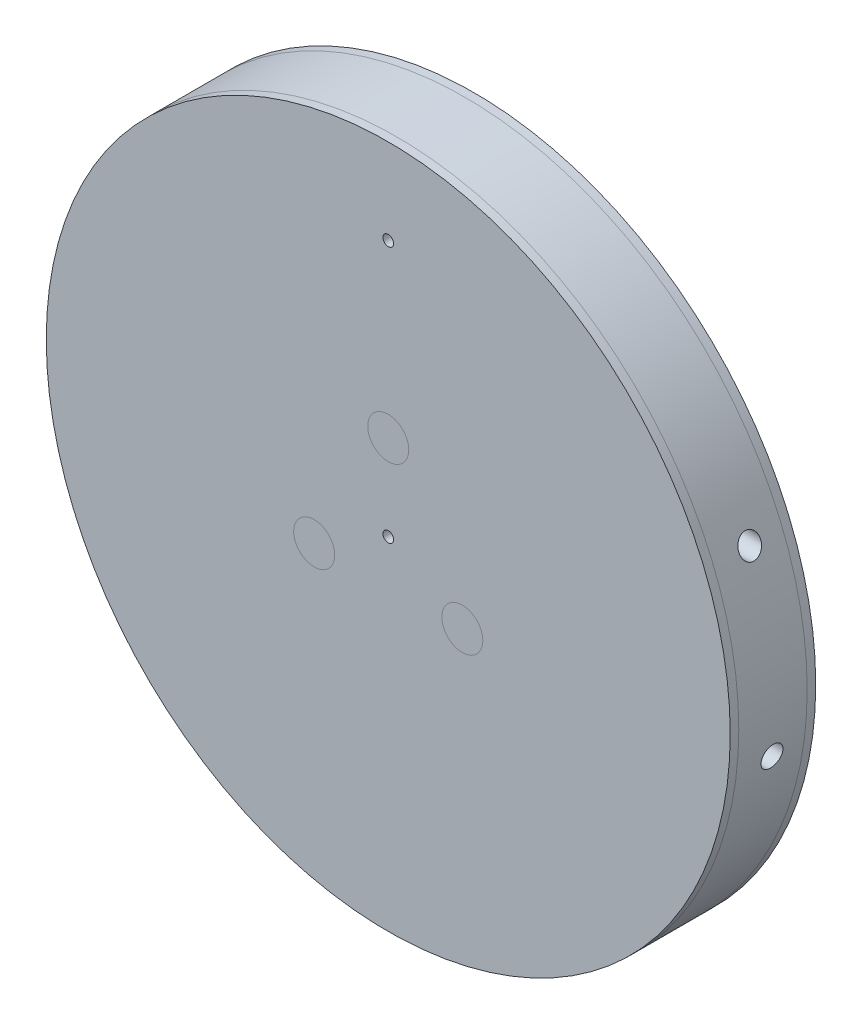
from build123d import *

# Parameters (mm, degrees)
SKETCH1_R               = 100
BOSS_EXTRUDE1_DEPTH     = 25
CUT_EXTRUDE1_DEPTH      = 144.614066163
CUT_EXTRUDE1_DEPTH_BACK = 55.2975
SKETCH2_R               = 3.2
CUT_EXTRUDE2_DEPTH      = 144.61406632
CUT_EXTRUDE2_DEPTH_BACK = 54.7843
SKETCH3_R               = 3.2
CUT_EXTRUDE3_DEPTH      = 54.7843
CUT_EXTRUDE3_DEPTH_BACK = 144.61406632
SKETCH4_R               = 3.2
CUT_EXTRUDE4_DEPTH      = 55.2975
CUT_EXTRUDE4_DEPTH_BACK = 144.61406632
SKETCH5_R               = 3.2
SKETCH6_R               = 50
BOSS_EXTRUDE5_DEPTH     = 0.1
SKETCH8_R               = 50
BOSS_EXTRUDE6_DEPTH     = 0.525
SKETCH10_R              = 1.55
CUT_EXTRUDE5_DEPTH      = 21
SKETCH11_R              = 1.55
CUT_EXTRUDE6_DEPTH      = 21


with BuildPart() as part:
    # Sketch1 → Boss-Extrude1 (new body)
    with BuildSketch(Plane.XY):
        Circle(SKETCH1_R)
    extrude(amount=BOSS_EXTRUDE1_DEPTH)

    # Sketch2 → Cut-Extrude1 (cut, two sides: drawn at the far end of the back side and taken through both)
    with BuildSketch(Plane(origin=(0, 0, 0), x_dir=(0, 0, -1), z_dir=(1, 0, 0)).offset(-CUT_EXTRUDE1_DEPTH_BACK)):
        with Locations((-12, 37.5)):
            Circle(SKETCH2_R)
    extrude(amount=CUT_EXTRUDE1_DEPTH + CUT_EXTRUDE1_DEPTH_BACK, mode=Mode.SUBTRACT)

    # Sketch3 → Cut-Extrude2 (cut, two sides: drawn at the far end of the back side and taken through both)
    with BuildSketch(Plane(origin=(0, 0, 0), x_dir=(0, 0, -1), z_dir=(1, 0, 0)).offset(-CUT_EXTRUDE2_DEPTH_BACK)):
        with Locations((-12, -12.5)):
            Circle(SKETCH3_R)
    extrude(amount=CUT_EXTRUDE2_DEPTH + CUT_EXTRUDE2_DEPTH_BACK, mode=Mode.SUBTRACT)

    # Sketch4 → Cut-Extrude3 (cut, two sides: drawn at the far end of the back side and taken through both)
    with BuildSketch(Plane(origin=(0, 0, 0), x_dir=(0, 0, -1), z_dir=(1, 0, 0)).offset(-CUT_EXTRUDE3_DEPTH_BACK)):
        with Locations((-12, 12.5)):
            Circle(SKETCH4_R)
    extrude(amount=CUT_EXTRUDE3_DEPTH + CUT_EXTRUDE3_DEPTH_BACK, mode=Mode.SUBTRACT)

    # Sketch5 → Cut-Extrude4 (cut, two sides: drawn at the far end of the back side and taken through both)
    with BuildSketch(Plane(origin=(0, 0, 0), x_dir=(0, 0, -1), z_dir=(1, 0, 0)).offset(-CUT_EXTRUDE4_DEPTH_BACK)):
        with Locations((-12, -37.5)):
            Circle(SKETCH5_R)
    extrude(amount=CUT_EXTRUDE4_DEPTH + CUT_EXTRUDE4_DEPTH_BACK, mode=Mode.SUBTRACT)

    # Sketch10 → Cut-Extrude5 (cut)
    with BuildSketch(Plane.XY.offset(25)):
        Circle(SKETCH10_R)
    extrude(amount=-CUT_EXTRUDE5_DEPTH, mode=Mode.SUBTRACT)

    # Sketch11 → Cut-Extrude6 (cut)
    with BuildSketch(Plane.XY.offset(25)):
        with Locations((0, 75)):
            Circle(SKETCH11_R)
    extrude(amount=-CUT_EXTRUDE6_DEPTH, mode=Mode.SUBTRACT)


with BuildPart() as body_2:
    # Sketch6 → Boss-Extrude5 (new body)
    with BuildSketch(Plane(origin=(0, 0, 0), x_dir=(-1, 0, 0), z_dir=(0, 0, -1))):
        Circle(SKETCH6_R)
    extrude(amount=BOSS_EXTRUDE5_DEPTH)


with BuildPart() as body_3:
    # Sketch8 → Boss-Extrude6 (new body)
    with BuildSketch(Plane(origin=(0, 0, -0.1), x_dir=(-1, 0, 0), z_dir=(0, 0, -1))):
        Circle(SKETCH8_R)
    extrude(amount=BOSS_EXTRUDE6_DEPTH)


solid = Compound([part.part, body_2.part, body_3.part])
